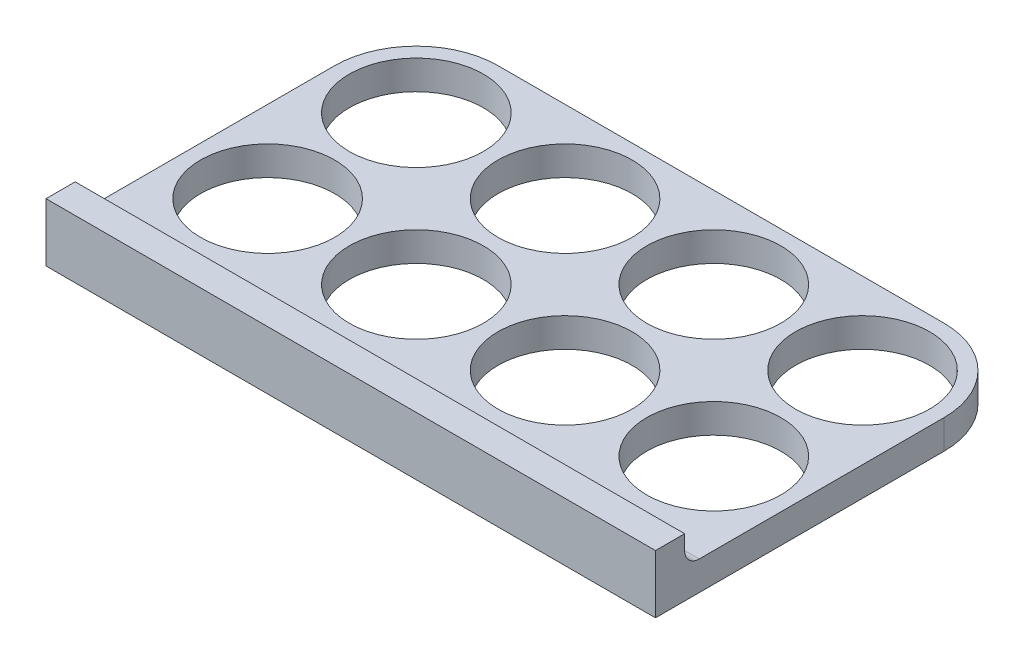
from build123d import *

# Parameters (mm, degrees)
SKETCH1_R           = 9.2
BOSS_EXTRUDE1_DEPTH = 4
SKETCH2_W           = 83.6
SKETCH2_H           = 4
BOSS_EXTRUDE2_DEPTH = 4
FILLET1_R           = 2


with BuildPart() as part:
    # Sketch1 → Boss-Extrude1 (new body)
    with BuildSketch(Plane(origin=(0, 0, 0), x_dir=(1, 0, 0), z_dir=(0, 1, 0))):
        with BuildLine():
            Line((-11.2, 20.4), (-11.2, -19.2))
            Line((-11.2, -19.2), (72.4, -19.2))
            Line((72.4, -19.2), (72.4, 20.4))
            ThreePointArc((72.4, 20.4), (69.119595949, 28.319595949), (61.2, 31.6))
            Line((61.2, 31.6), (0, 31.6))
            ThreePointArc((0, 31.6), (-7.919595949, 28.319595949), (-11.2, 20.4))
        make_face()
        with Locations(Location((0, 0, 0), (0, 0, 270))):
            Circle(SKETCH1_R, mode=Mode.SUBTRACT)
        with Locations(Location((20.4, 0, 0), (0, 0, 270))):
            Circle(SKETCH1_R, mode=Mode.SUBTRACT)
        with Locations(Location((40.8, 0, 0), (0, 0, 270))):
            Circle(SKETCH1_R, mode=Mode.SUBTRACT)
        with Locations(Location((61.2, 0, 0), (0, 0, 270))):
            Circle(SKETCH1_R, mode=Mode.SUBTRACT)
        with Locations(Location((20.4, 20.4, 0), (0, 0, 270))):
            Circle(SKETCH1_R, mode=Mode.SUBTRACT)
        with Locations(Location((40.8, 20.4, 0), (0, 0, 270))):
            Circle(SKETCH1_R, mode=Mode.SUBTRACT)
        with Locations(Location((61.2, 20.4, 0), (0, 0, 270))):
            Circle(SKETCH1_R, mode=Mode.SUBTRACT)
        with Locations(Location((0, 20.4, 0), (0, 0, 270))):
            Circle(SKETCH1_R, mode=Mode.SUBTRACT)
    extrude(amount=BOSS_EXTRUDE1_DEPTH)

    # Sketch2 → Boss-Extrude2 (add)
    with BuildSketch(Plane(origin=(0, 4, 0), x_dir=(1, 0, 0), z_dir=(0, 1, 0))):
        with Locations((30.6, -17.2)):
            Rectangle(SKETCH2_W, SKETCH2_H)
    extrude(amount=BOSS_EXTRUDE2_DEPTH)

    # Fillet1
    fillet1_edges = [part.edges().sort_by_distance(p)[0] for p in [
        (30.6, 4, 15.2),
    ]]
    fillet(fillet1_edges, radius=FILLET1_R)


solid = part.part
